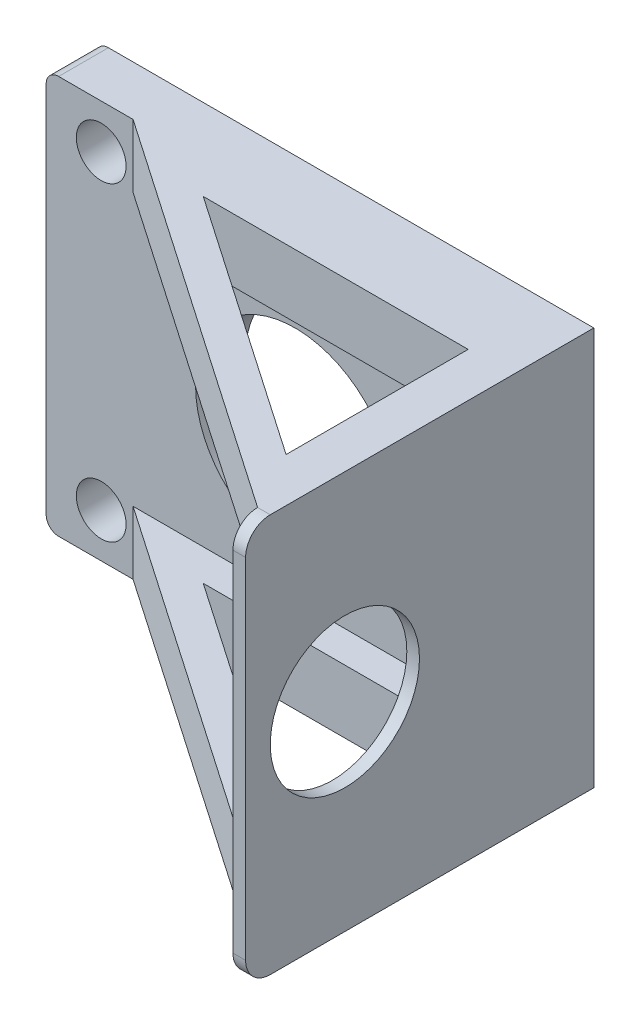
from build123d import *

# Parameters (mm, degrees)
SKETCH1_R           = 10
SKETCH1_R_2         = 40
BOSS_EXTRUDE1_DEPTH = 20
SKETCH2_W           = 119.888
SKETCH2_H           = 160
BOSS_EXTRUDE3_DEPTH = 5.08
SKETCH2_7_R         = 29.972
CUT_EXTRUDE1_DEPTH  = 257.843634424
FILLET1_R           = 9.906
FILLET2_R           = 9.906
BOSS_EXTRUDE4_DEPTH = 25.4
BOSS_EXTRUDE5_DEPTH = 25.4


with BuildPart() as part:
    # Sketch1 → Boss-Extrude1 (new body)
    with BuildSketch(Plane.XY.offset(20)):
        with BuildLine():
            Line((95, 80), (-95, 80))
            ThreePointArc((-95, 80), (-98.535533906, 78.535533906), (-100, 75))
            Line((-100, 75), (-100, -75))
            ThreePointArc((-100, -75), (-98.535533906, -78.535533906), (-95, -80))
            Line((-95, -80), (95, -80))
            Line((95, -80), (100, -80))
            Line((100, -80), (100, -75))
            Line((100, -75), (100, 75))
            Line((100, 75), (100, 80))
            Line((100, 80), (95, 80))
        make_face()
        with Locations((-77.895356155, 62.316284924)):
            Circle(SKETCH1_R, mode=Mode.SUBTRACT)
        with Locations((83.46, 0.37)):
            Circle(SKETCH1_R, mode=Mode.SUBTRACT)
        with Locations((-77.895356155, -62.316284924)):
            Circle(SKETCH1_R, mode=Mode.SUBTRACT)
        Circle(SKETCH1_R_2, mode=Mode.SUBTRACT)
    extrude(amount=-BOSS_EXTRUDE1_DEPTH)

    # Sketch2 → Boss-Extrude3 (add)
    with BuildSketch(Plane(origin=(100, 0, 0), x_dir=(0, 0, -1), z_dir=(1, 0, 0))):
        with Locations((-79.944, 0)):
            Rectangle(SKETCH2_W, SKETCH2_H)
    extrude(amount=-BOSS_EXTRUDE3_DEPTH)

    # Sketch2<7> → Cut-Extrude1 (cut, through all)
    with BuildSketch(Plane(origin=(100, 0, 0), x_dir=(0, 0, -1), z_dir=(1, 0, 0))):
        with Locations((-100.01, 0)):
            Circle(SKETCH2_7_R)
    extrude(amount=-CUT_EXTRUDE1_DEPTH, mode=Mode.SUBTRACT)

    # Fillet1
    fillet1_edges = [part.edges().sort_by_distance(p)[0] for p in [
        (97.46, 80, 139.888),
    ]]
    fillet(fillet1_edges, radius=FILLET1_R)

    # Fillet2
    fillet2_edges = [part.edges().sort_by_distance(p)[0] for p in [
        (97.46, -80, 139.888),
    ]]
    fillet(fillet2_edges, radius=FILLET2_R)

    # Sketch4 → Boss-Extrude4 (add)
    with BuildSketch(Plane.XZ.offset(80)):
        Polygon((94.92, 129.982), (94.92, 20), (-65.1, 20), align=None)
        Polygon((82.22, 32.7), (-24.200327544, 32.7), (82.22, 105.842860042), align=None, mode=Mode.SUBTRACT)
    extrude(amount=-BOSS_EXTRUDE4_DEPTH)

    # Sketch5 → Boss-Extrude5 (add)
    with BuildSketch(Plane(origin=(0, 80, 0), x_dir=(1, 0, 0), z_dir=(0, 1, 0))):
        Polygon((94.92, -129.982), (94.92, -20), (-65.1, -20), align=None)
        Polygon((-24.200327544, -32.7), (82.22, -105.842860042), (82.22, -32.7), align=None, mode=Mode.SUBTRACT)
    extrude(amount=-BOSS_EXTRUDE5_DEPTH)


solid = part.part
